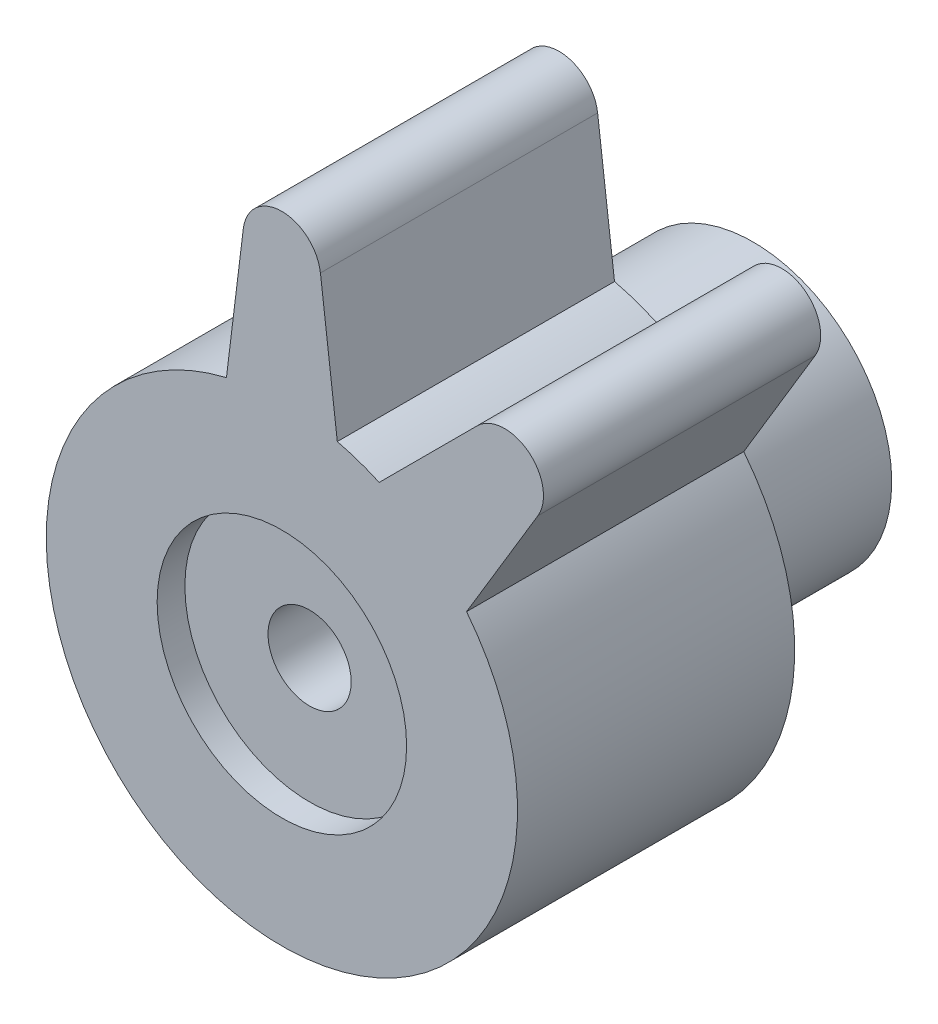
from build123d import *

# Parameters (mm, degrees)
SKETCH1_R           = 1.5
BOSS_EXTRUDE1_DEPTH = 10
SKETCH5_R           = 5
BOSS_EXTRUDE3_DEPTH = 7
SKETCH8_R           = 4.5
CUT_EXTRUDE2_DEPTH  = 1


with BuildPart() as part:
    # Sketch1 → Boss-Extrude1 (new body)
    with BuildSketch(Plane.XY):
        with BuildLine():
            Line((-1.390653283, 13.224086579), (-2, 8.261355821))
            ThreePointArc((-2, 8.261355821), (-2.767329313, -8.036907893), (6.66222002, 5.278714276))
            Line((6.66222002, 5.278714276), (9.237410395, 9.564550779))
            ThreePointArc((9.237410395, 9.564550779), (8.899037344, 11.390248383), (7.045710912, 11.276894083))
            Line((7.045710912, 11.276894083), (3.510177006, 7.741360177))
            ThreePointArc((3.510177006, 7.741360177), (2.767329313, 8.036907893), (2, 8.261355821))
            Line((2, 8.261355821), (1.390653283, 13.224086579))
            ThreePointArc((1.390653283, 13.224086579), (0, 14.454432673), (-1.390653283, 13.224086579))
        make_face()
        Circle(SKETCH1_R, mode=Mode.SUBTRACT)
    extrude(amount=BOSS_EXTRUDE1_DEPTH)

    # Sketch5 → Boss-Extrude3 (add)
    with BuildSketch(Plane(origin=(0, 0, 0), x_dir=(-1, 0, 0), z_dir=(0, 0, -1))):
        with Locations(Location((0, 0, 0), (0, 0, 180))):
            Circle(SKETCH5_R)
        with BuildLine():
            Line((1.95, -2.6), (-1.95, -2.6))
            ThreePointArc((-1.95, -2.6), (0, 3.25), (1.95, -2.6))
        make_face(mode=Mode.SUBTRACT)
    extrude(amount=BOSS_EXTRUDE3_DEPTH)

    # Sketch8 → Cut-Extrude2 (cut)
    with BuildSketch(Plane.XY.offset(10)):
        Circle(SKETCH8_R)
    extrude(amount=-CUT_EXTRUDE2_DEPTH, mode=Mode.SUBTRACT)


solid = part.part
